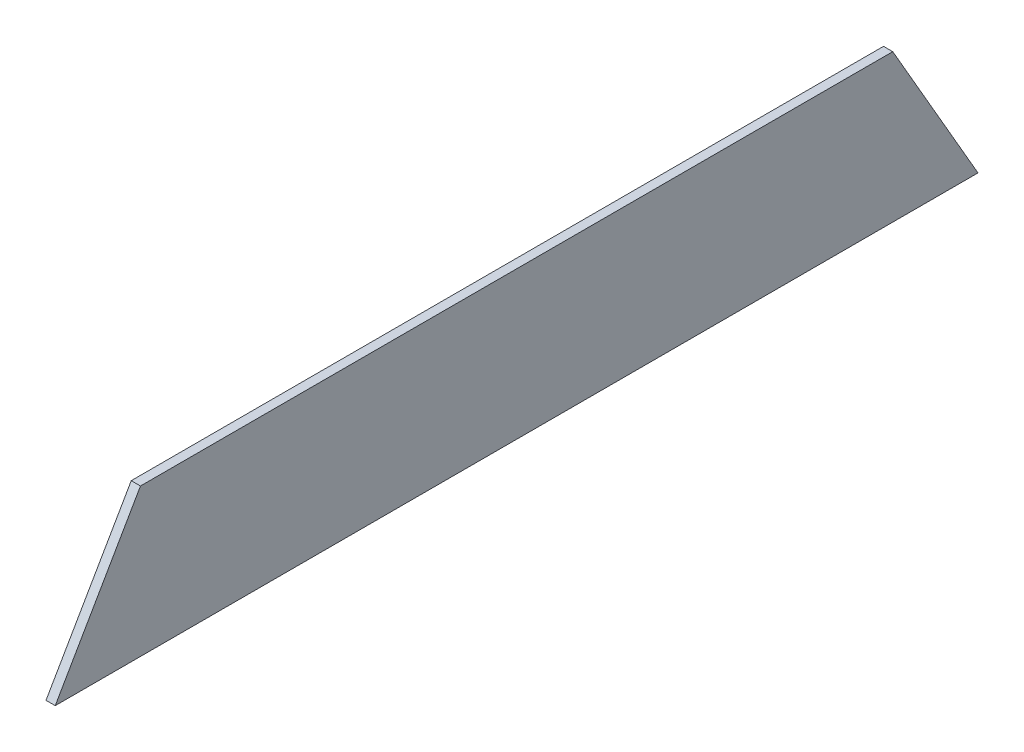
from build123d import *

# Parameters (mm, degrees)
BOSS_EXTRUDE1_DEPTH = 1.5875


with BuildPart() as part:
    # Sketch1 → Boss-Extrude1 (new body)
    with BuildSketch(Plane(origin=(0, 0, 0), x_dir=(0, 0, -1), z_dir=(1, 0, 0))):
        Polygon((-158.75, 0), (-144.085303163, 25.4), (-14.664696837, 25.4), (0, 0), align=None)
    extrude(amount=BOSS_EXTRUDE1_DEPTH)


solid = part.part
